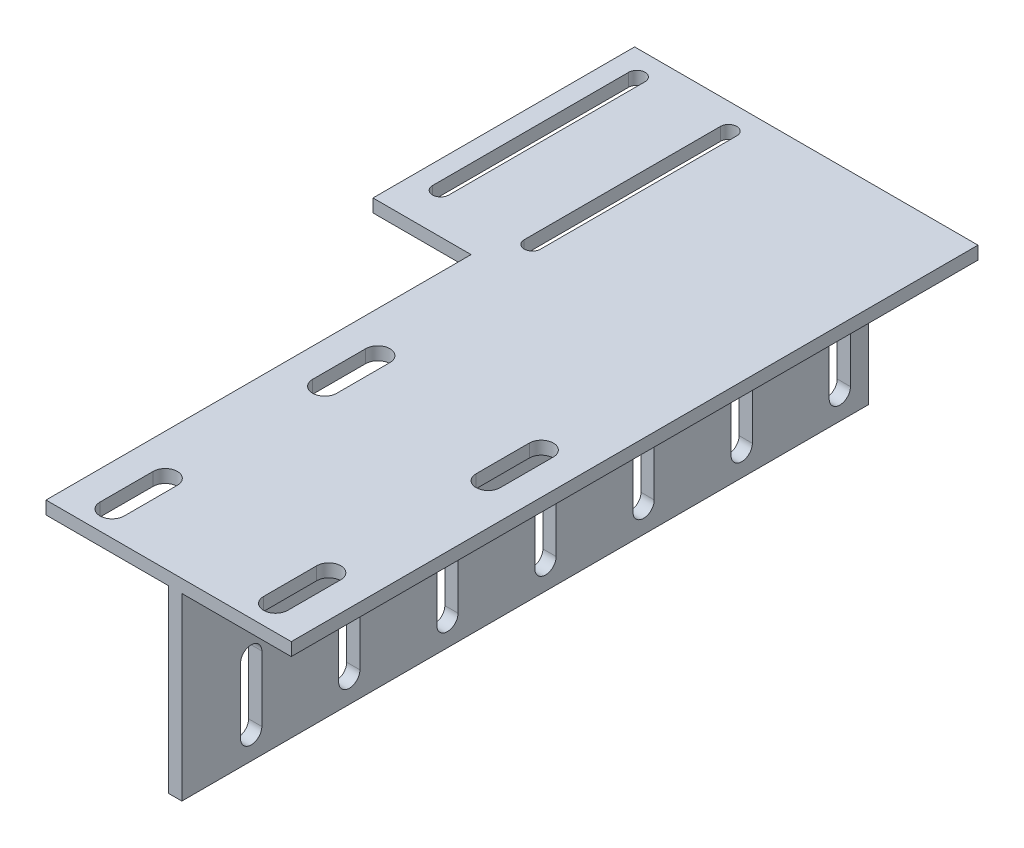
from build123d import *

# Parameters (mm, degrees)
CROQUIS1_W              = 60
CROQUIS1_H              = 160.023288417
SALIENTE_EXTRUIR1_DEPTH = 7.9375
CROQUIS2_W              = 8.086078182
CROQUIS2_H              = 420
SALIENTE_EXTRUIR2_DEPTH = 110
CORTAR_EXTRUIR1_DEPTH   = 10


with BuildPart() as part:
    # Croquis1 → Saliente-Extruir1 (new body)
    # profile 1 of 2: a face of its own
    with BuildSketch(Plane(origin=(0, 0, 0), x_dir=(1, 0, 0), z_dir=(0, 1, 0))):
        Polygon((75, 210), (-75, 210), (-75, 49.976711583), (-75, -210), (75, -210), align=None)
        with BuildLine():
            ThreePointArc((-42.626797059, -194.544827159), (-50.012947046, -201.930977146), (-57.399097033, -194.544827159))
            Line((-57.399097033, -194.544827159), (-57.399097033, -162.050045053))
            ThreePointArc((-57.399097033, -162.050045053), (-50.012947046, -154.663895066), (-42.626797059, -162.050045053))
            Line((-42.626797059, -162.050045053), (-42.626797059, -194.544827159))
        make_face(mode=Mode.SUBTRACT)
        with BuildLine():
            ThreePointArc((-42.626797059, -64.544827159), (-50.012947046, -71.930977146), (-57.399097033, -64.544827159))
            Line((-57.399097033, -64.544827159), (-57.399097033, -32.050045053))
            ThreePointArc((-57.399097033, -32.050045053), (-50.012947046, -24.663895066), (-42.626797059, -32.050045053))
            Line((-42.626797059, -32.050045053), (-42.626797059, -64.544827159))
        make_face(mode=Mode.SUBTRACT)
        with BuildLine():
            ThreePointArc((57.373202941, -194.544827159), (49.987052954, -201.930977146), (42.600902967, -194.544827159))
            Line((42.600902967, -194.544827159), (42.600902967, -162.050045053))
            ThreePointArc((42.600902967, -162.050045053), (49.987052954, -154.663895066), (57.373202941, -162.050045053))
            Line((57.373202941, -162.050045053), (57.373202941, -194.544827159))
        make_face(mode=Mode.SUBTRACT)
        with BuildLine():
            ThreePointArc((57.373202941, -64.544827159), (49.987052954, -71.930977146), (42.600902967, -64.544827159))
            Line((42.600902967, -64.544827159), (42.600902967, -32.050045053))
            ThreePointArc((42.600902967, -32.050045053), (49.987052954, -24.663895066), (57.373202941, -32.050045053))
            Line((57.373202941, -32.050045053), (57.373202941, -64.544827159))
        make_face(mode=Mode.SUBTRACT)
        with BuildLine():
            ThreePointArc((-66.642728039, 194.133584854), (-61.642728039, 199.133584854), (-56.642728039, 194.133584854))
            Line((-56.642728039, 194.133584854), (-56.642728039, 74.133584854))
            ThreePointArc((-56.642728039, 74.133584854), (-61.642728039, 69.133584854), (-66.642728039, 74.133584854))
            Line((-66.642728039, 74.133584854), (-66.642728039, 194.133584854))
        make_face(mode=Mode.SUBTRACT)
    # profile 2 of 2: a face of its own
    with BuildSketch(Plane(origin=(0, 0, 0), x_dir=(1, 0, 0), z_dir=(0, 1, 0))):
        with Locations((-105, 129.988355791)):
            Rectangle(CROQUIS1_W, CROQUIS1_H)
        with BuildLine():
            ThreePointArc((-123.366972213, 194.743931483), (-118.366972213, 199.743931483), (-113.366972213, 194.743931483))
            Line((-113.366972213, 194.743931483), (-113.366972213, 74.743931483))
            ThreePointArc((-113.366972213, 74.743931483), (-118.366972213, 69.743931483), (-123.366972213, 74.743931483))
            Line((-123.366972213, 74.743931483), (-123.366972213, 194.743931483))
        make_face(mode=Mode.SUBTRACT)
    extrude(amount=SALIENTE_EXTRUIR1_DEPTH)

    # Croquis2 → Saliente-Extruir2 (add)
    with BuildSketch(Plane.XZ):
        with Locations((4.043039091, 0)):
            Rectangle(CROQUIS2_W, CROQUIS2_H)
    extrude(amount=SALIENTE_EXTRUIR2_DEPTH)

    # Croquis3 → Cortar-Extruir1 (cut)
    with BuildSketch(Plane.ZY):
        with BuildLine():
            Line((-185.90944112, -54.927638628), (-185.90944112, -94.927638628))
            ThreePointArc((-185.90944112, -94.927638628), (-192.40944112, -101.427638628), (-198.90944112, -94.927638628))
            Line((-198.90944112, -94.927638628), (-198.90944112, -54.927638628))
            ThreePointArc((-198.90944112, -54.927638628), (-192.40944112, -48.427638628), (-185.90944112, -54.927638628))
        make_face()
        with BuildLine():
            Line((-125.90944112, -54.927638628), (-125.90944112, -94.927638628))
            ThreePointArc((-125.90944112, -94.927638628), (-132.40944112, -101.427638628), (-138.90944112, -94.927638628))
            Line((-138.90944112, -94.927638628), (-138.90944112, -54.927638628))
            ThreePointArc((-138.90944112, -54.927638628), (-132.40944112, -48.427638628), (-125.90944112, -54.927638628))
        make_face()
        with BuildLine():
            Line((-65.90944112, -54.927638628), (-65.90944112, -94.927638628))
            ThreePointArc((-65.90944112, -94.927638628), (-72.40944112, -101.427638628), (-78.90944112, -94.927638628))
            Line((-78.90944112, -94.927638628), (-78.90944112, -54.927638628))
            ThreePointArc((-78.90944112, -54.927638628), (-72.40944112, -48.427638628), (-65.90944112, -54.927638628))
        make_face()
        with BuildLine():
            Line((-5.90944112, -54.927638628), (-5.90944112, -94.927638628))
            ThreePointArc((-5.90944112, -94.927638628), (-12.40944112, -101.427638628), (-18.90944112, -94.927638628))
            Line((-18.90944112, -94.927638628), (-18.90944112, -54.927638628))
            ThreePointArc((-18.90944112, -54.927638628), (-12.40944112, -48.427638628), (-5.90944112, -54.927638628))
        make_face()
        with BuildLine():
            Line((54.09055888, -54.927638628), (54.09055888, -94.927638628))
            ThreePointArc((54.09055888, -94.927638628), (47.59055888, -101.427638628), (41.09055888, -94.927638628))
            Line((41.09055888, -94.927638628), (41.09055888, -54.927638628))
            ThreePointArc((41.09055888, -54.927638628), (47.59055888, -48.427638628), (54.09055888, -54.927638628))
        make_face()
        with BuildLine():
            Line((114.09055888, -54.927638628), (114.09055888, -94.927638628))
            ThreePointArc((114.09055888, -94.927638628), (107.59055888, -101.427638628), (101.09055888, -94.927638628))
            Line((101.09055888, -94.927638628), (101.09055888, -54.927638628))
            ThreePointArc((101.09055888, -54.927638628), (107.59055888, -48.427638628), (114.09055888, -54.927638628))
        make_face()
        with BuildLine():
            Line((174.09055888, -54.927638628), (174.09055888, -94.927638628))
            ThreePointArc((174.09055888, -94.927638628), (167.59055888, -101.427638628), (161.09055888, -94.927638628))
            Line((161.09055888, -94.927638628), (161.09055888, -54.927638628))
            ThreePointArc((161.09055888, -54.927638628), (167.59055888, -48.427638628), (174.09055888, -54.927638628))
        make_face()
    extrude(amount=-CORTAR_EXTRUIR1_DEPTH, mode=Mode.SUBTRACT)


solid = part.part
